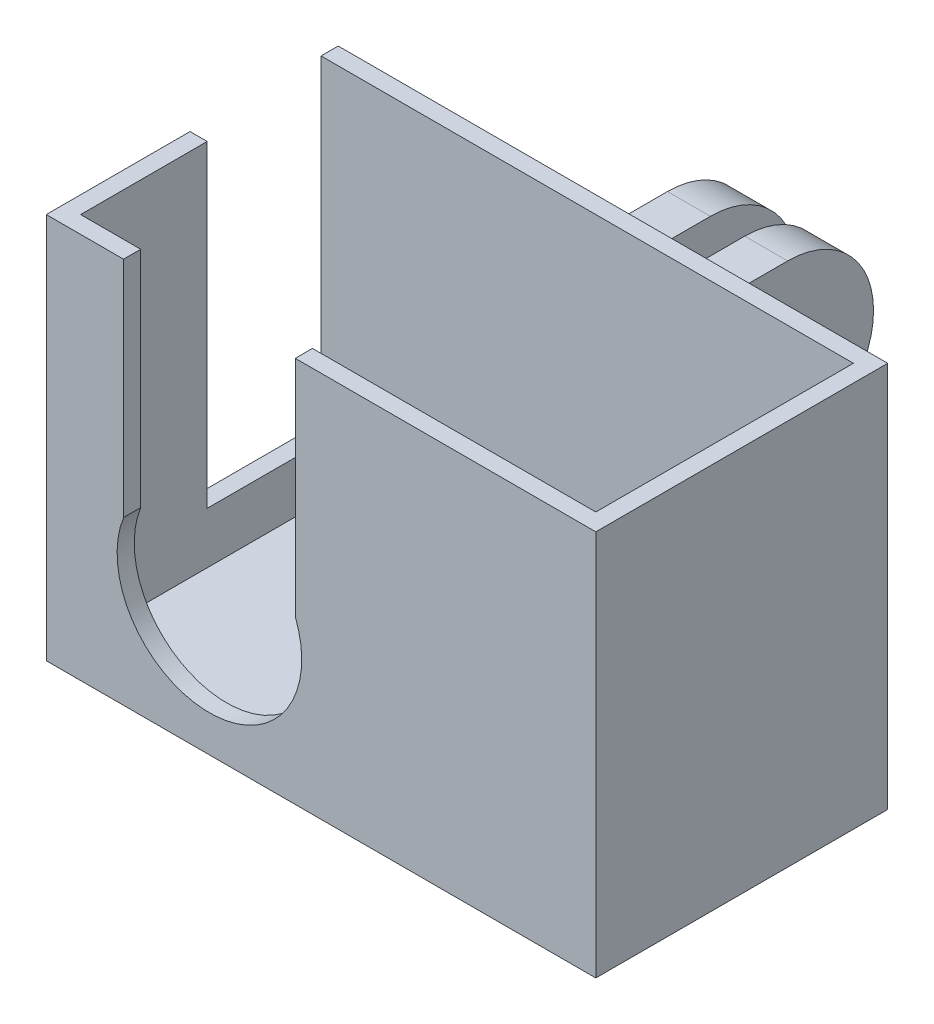
from build123d import *

# Parameters (mm, degrees)
SKETCH1_W           = 64
SKETCH1_H           = 45
BOSS_EXTRUDE1_DEPTH = 34
SKETCH2_R           = 10.75
CUT_EXTRUDE1_DEPTH  = 6
CUT_EXTRUDE2_START  = -2
SKETCH3_W           = 60
SKETCH3_H           = 41
CUT_EXTRUDE2_DEPTH  = 27
SKETCH4_W           = 60
SKETCH4_H           = 30
CUT_EXTRUDE3_DEPTH  = 43
SKETCH5_W           = 20
SKETCH5_H           = 2
CUT_EXTRUDE4_DEPTH  = 27
BOSS_EXTRUDE2_START = 2
BOSS_EXTRUDE2_DEPTH = 5
BOSS_EXTRUDE3_START = -7
BOSS_EXTRUDE3_DEPTH = 5
SKETCH10_W          = 15.255500618
SKETCH10_H          = 37
CUT_EXTRUDE5_DEPTH  = 2


with BuildPart() as part:
    # Sketch1 → Boss-Extrude1 (new body)
    with BuildSketch(Plane.XY):
        with Locations((1.653781513, -3.994957983)):
            Rectangle(SKETCH1_W, SKETCH1_H)
    extrude(amount=BOSS_EXTRUDE1_DEPTH)

    # Sketch2 → Cut-Extrude1 (cut)
    with BuildSketch(Plane.XY.offset(34)):
        with Locations((-11.346218487, -11.494957983)):
            Circle(SKETCH2_R)
    extrude(amount=-CUT_EXTRUDE1_DEPTH, mode=Mode.SUBTRACT)

    # Sketch3 → Cut-Extrude2 (cut)
    with BuildSketch(Plane.XY.offset(34).offset(CUT_EXTRUDE2_START)):
        with Locations((1.653781513, -3.994957983)):
            Rectangle(SKETCH3_W, SKETCH3_H)
    extrude(amount=-CUT_EXTRUDE2_DEPTH, mode=Mode.SUBTRACT)

    # Sketch4 → Cut-Extrude3 (cut)
    with BuildSketch(Plane(origin=(0, 18.505042017, 0), x_dir=(1, 0, 0), z_dir=(0, 1, 0))):
        with Locations((1.653781513, -17)):
            Rectangle(SKETCH4_W, SKETCH4_H)
    extrude(amount=-CUT_EXTRUDE3_DEPTH, mode=Mode.SUBTRACT)

    # Sketch5 → Cut-Extrude4 (cut)
    with BuildSketch(Plane(origin=(0, 18.505042017, 0), x_dir=(1, 0, 0), z_dir=(0, 1, 0))):
        with Locations((-11.346218487, -33)):
            Rectangle(SKETCH5_W, SKETCH5_H)
    extrude(amount=-CUT_EXTRUDE4_DEPTH, mode=Mode.SUBTRACT)

    # Sketch7 → Boss-Extrude2 (add)
    with BuildSketch(Plane(origin=(0, 0, 0), x_dir=(0, 0, -1), z_dir=(1, 0, 0)).offset(BOSS_EXTRUDE2_START)):
        with BuildLine():
            Line((0, 7.999642933), (15, 7.999642933))
            ThreePointArc((15, 7.999642933), (25, -2.000357067), (15, -12.000357067))
            Line((15, -12.000357067), (0, -12.000357067))
            Line((0, -12.000357067), (0, 7.999642933))
        make_face()
    extrude(amount=BOSS_EXTRUDE2_DEPTH)

    # Sketch8 → Boss-Extrude3 (add)
    with BuildSketch(Plane(origin=(0, 0, 0), x_dir=(0, 0, -1), z_dir=(1, 0, 0)).offset(BOSS_EXTRUDE3_START)):
        with BuildLine():
            Line((0, -12.000357067), (0, 7.999642933))
            Line((0, 7.999642933), (15, 7.999642933))
            ThreePointArc((15, 7.999642933), (25, -2.000357067), (15, -12.000357067))
            Line((15, -12.000357067), (0, -12.000357067))
        make_face()
    extrude(amount=BOSS_EXTRUDE3_DEPTH)

    # Sketch10 → Cut-Extrude5 (cut)
    with BuildSketch(Plane.ZY.offset(30.346218487)):
        with Locations((9.627750309, 0.005042017)):
            Rectangle(SKETCH10_W, SKETCH10_H)
    extrude(amount=-CUT_EXTRUDE5_DEPTH, mode=Mode.SUBTRACT)


solid = part.part
